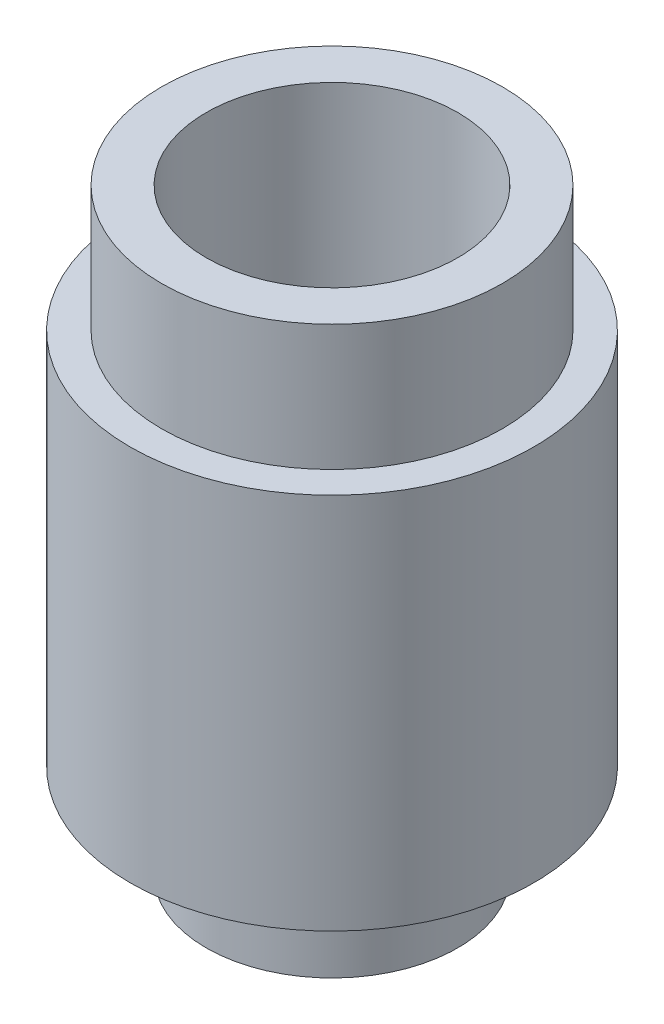
from build123d import *

# Parameters (mm, degrees)
SKETCH1_R           = 3.85
BOSS_EXTRUDE1_DEPTH = 7.2
SKETCH3_R           = 3.25
SKETCH3_R_2         = 2.4
BOSS_EXTRUDE2_DEPTH = 8
SKETCH4_R           = 2.4
CUT_EXTRUDE2_DEPTH  = 5.6
BOSS_EXTRUDE3_START = -5.6
SKETCH5_R           = 2.4
SKETCH5_R_2         = 1.7
BOSS_EXTRUDE3_DEPTH = 5.6
SKETCH6_R           = 1.7
CUT_EXTRUDE3_DEPTH  = 12.036530252


with BuildPart() as part:
    # Sketch1 → Boss-Extrude1 (new body)
    with BuildSketch(Plane(origin=(0, 0, 0), x_dir=(1, 0, 0), z_dir=(0, 1, 0))):
        with Locations(Location((0, 0, 0), (0, 0, 270))):
            Circle(SKETCH1_R)
    extrude(amount=BOSS_EXTRUDE1_DEPTH)

    # Sketch3 → Boss-Extrude2 (add)
    with BuildSketch(Plane(origin=(0, 9.6, 0), x_dir=(1, 0, 0), z_dir=(0, 1, 0))):
        with Locations(Location((0, 0, 0), (0, 0, 270))):
            Circle(SKETCH3_R)
        with Locations(Location((0, 0, 0), (0, 0, 270))):
            Circle(SKETCH3_R_2, mode=Mode.SUBTRACT)
    extrude(amount=-BOSS_EXTRUDE2_DEPTH)

    # Sketch4 → Cut-Extrude2 (cut)
    with BuildSketch(Plane(origin=(0, 7.2, 0), x_dir=(1, 0, 0), z_dir=(0, 1, 0))):
        with Locations(Location((0, 0, 0), (0, 0, 270))):
            Circle(SKETCH4_R)
    extrude(amount=-CUT_EXTRUDE2_DEPTH, mode=Mode.SUBTRACT)

    # Sketch5 → Boss-Extrude3 (add)
    with BuildSketch(Plane(origin=(0, -1.8, 0), x_dir=(-1, 0, 0), z_dir=(0, -1, 0)).offset(BOSS_EXTRUDE3_START)):
        with Locations(Location((0, 0, 0), (0, 0, 270))):
            Circle(SKETCH5_R)
        with Locations(Location((0, 0, 0), (0, 0, 90))):
            Circle(SKETCH5_R_2, mode=Mode.SUBTRACT)
    extrude(amount=BOSS_EXTRUDE3_DEPTH)

    # Sketch6 → Cut-Extrude3 (cut, through all)
    with BuildSketch(Plane.XZ):
        with Locations(Location((0, 0, 0), (0, 0, 270))):
            Circle(SKETCH6_R)
    extrude(amount=-CUT_EXTRUDE3_DEPTH, mode=Mode.SUBTRACT)


solid = part.part
